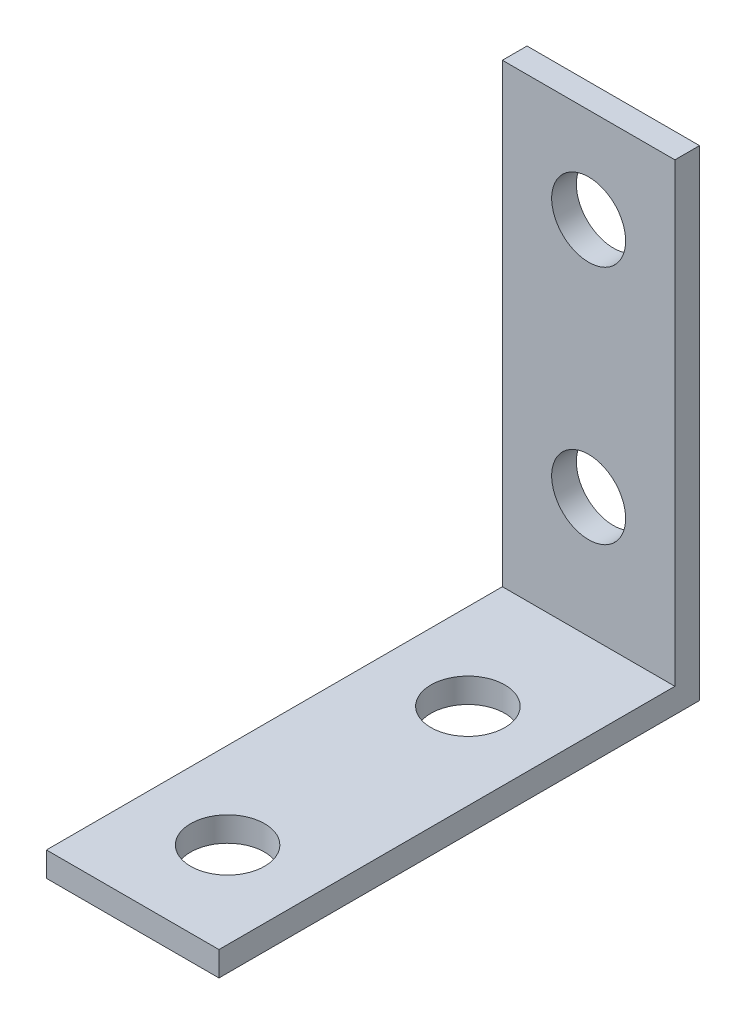
from build123d import *

# Parameters (mm, degrees)
BOSS_EXTRUDE1_DEPTH = 14
SKETCH2_R           = 3
CUT_EXTRUDE1_DEPTH  = 46.02225292
SKETCH3_R           = 3
CUT_EXTRUDE2_DEPTH  = 56.551777649


with BuildPart() as part:
    # Sketch1 → Boss-Extrude1 (new body)
    with BuildSketch(Plane(origin=(0, 0, 0), x_dir=(0, 0, -1), z_dir=(1, 0, 0))):
        Polygon((-21.494261048, 2), (15.505738952, 2), (15.505738952, 39), (17.505738952, 39), (17.505738952, 0), (-21.494261048, 0), align=None)
    extrude(amount=BOSS_EXTRUDE1_DEPTH)

    # Sketch2 → Cut-Extrude1 (cut, through all)
    with BuildSketch(Plane(origin=(0, 2, 0), x_dir=(1, 0, 0), z_dir=(0, 1, 0))):
        with Locations(Location((7, -13.794261048, 0), (0, 0, 270))):
            Circle(SKETCH2_R)
        with Locations(Location((7, 5.705738952, 0), (0, 0, 270))):
            Circle(SKETCH2_R)
    extrude(amount=-CUT_EXTRUDE1_DEPTH, mode=Mode.SUBTRACT)

    # Sketch3 → Cut-Extrude2 (cut, through all)
    with BuildSketch(Plane.XY.offset(-15.505738952)):
        with Locations((7, 11.8)):
            Circle(SKETCH3_R)
        with Locations((7, 31.3)):
            Circle(SKETCH3_R)
    extrude(amount=-CUT_EXTRUDE2_DEPTH, mode=Mode.SUBTRACT)


solid = part.part
